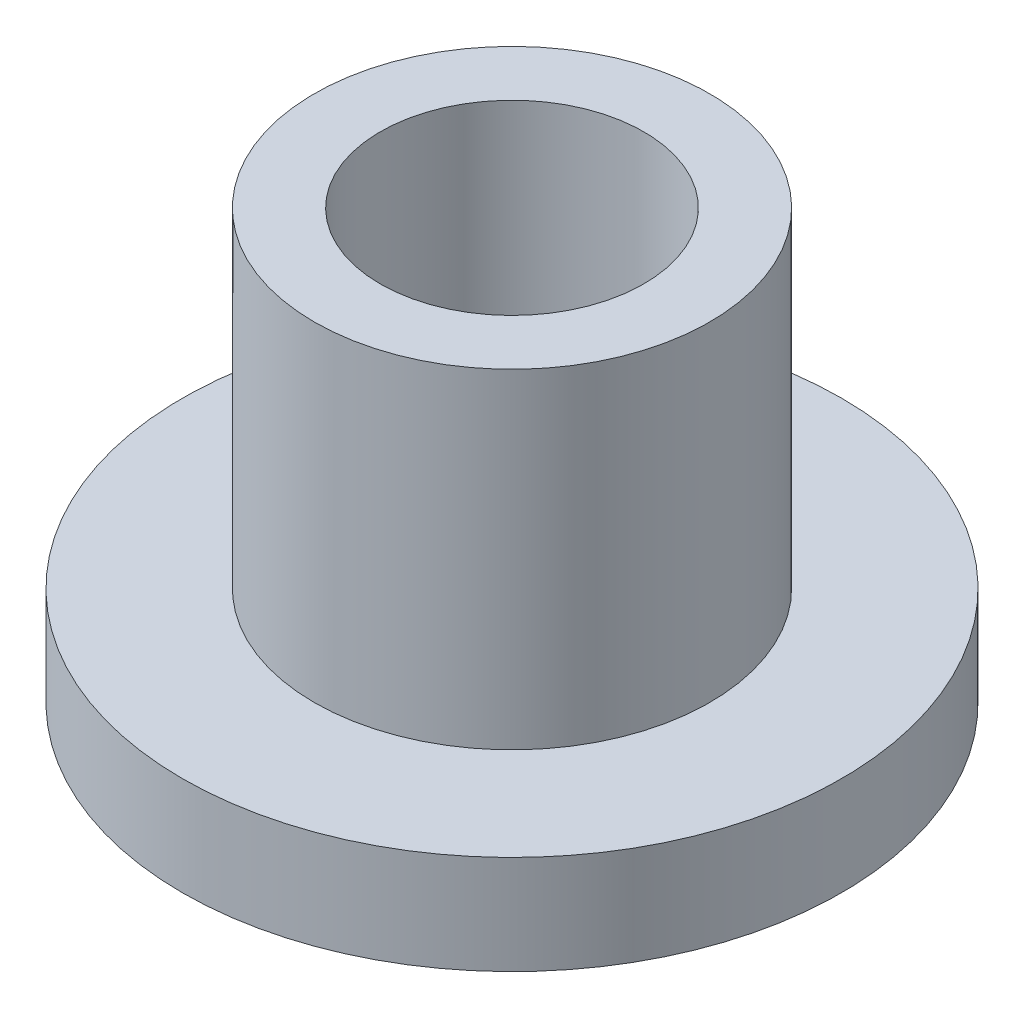
from build123d import *

# Parameters (mm, degrees)
SKETCH_1_R          = 20
EXTRUDE_1_DEPTH     = 6
SKETCH_2_R          = 12
EXTRUDE_2_DEPTH     = 20
SKETCH_3_R          = 8
CUT_EXTRUDE_3_DEPTH = 25


with BuildPart() as part:
    # Эскиз1 → Вытянуть1 (new body)
    with BuildSketch(Plane(origin=(0, 0, 0), x_dir=(1, 0, 0), z_dir=(0, 1, 0))):
        with Locations(Location((0, 0, 0), (0, 0, 270))):
            Circle(SKETCH_1_R)
    extrude(amount=EXTRUDE_1_DEPTH)

    # Эскиз2 → Вытянуть2 (add)
    with BuildSketch(Plane(origin=(0, 6, 0), x_dir=(1, 0, 0), z_dir=(0, 1, 0))):
        with Locations(Location((0, 0, 0), (0, 0, 270))):
            Circle(SKETCH_2_R)
    extrude(amount=EXTRUDE_2_DEPTH)

    # Эскиз3 → Вытянуть3 (cut)
    with BuildSketch(Plane(origin=(0, 26, 0), x_dir=(-1, 0, 0), z_dir=(0, 1, 0))):
        with Locations(Location((0, 0, 0), (0, 0, 90))):
            Circle(SKETCH_3_R)
    extrude(amount=-CUT_EXTRUDE_3_DEPTH, mode=Mode.SUBTRACT)


solid = part.part
